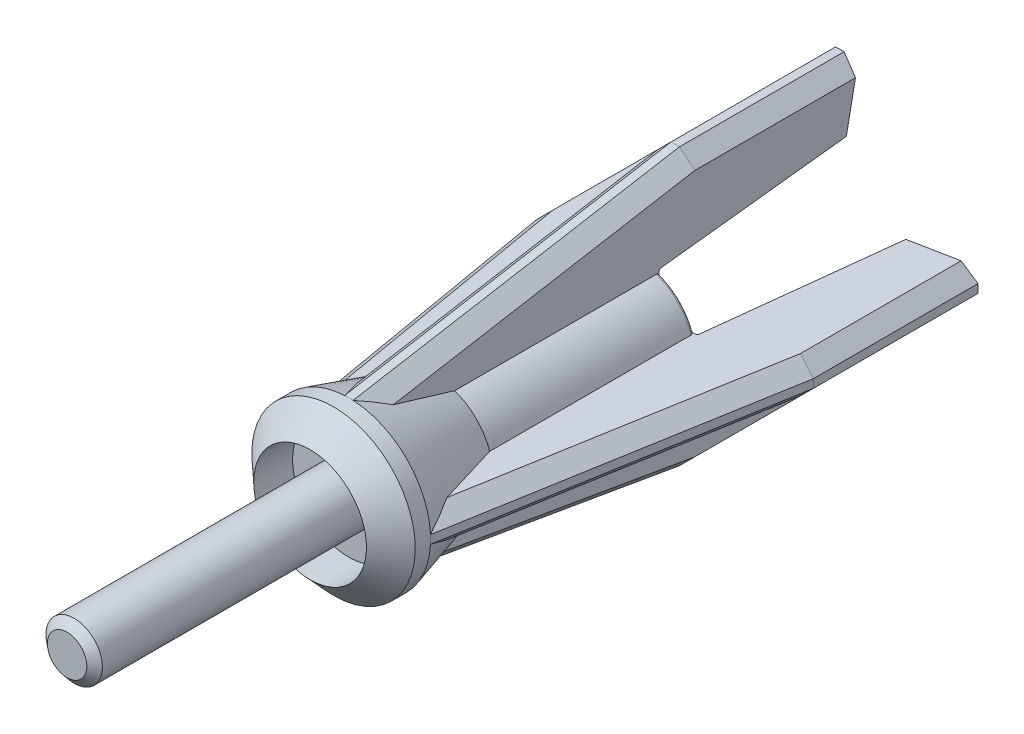
from build123d import *

# Parameters (mm, degrees)
EXTRUDE_1_DEPTH                      = 0.65
CHAMFER_1_SIZE                       = 0.5
PATTERN_CIRCULAR_2_COUNT             = 4
CHAMFER_1_OF_PATTERN_CIRCULAR_2_SIZE = 0.5
FILLET_1_R                           = 0.1


with BuildPart() as part:
    # 스케치1 → 회전1 (revolve)
    with BuildSketch(Plane(origin=(0, 0, 0), x_dir=(1, 0, 0), z_dir=(0, 1, 0)), mode=Mode.PRIVATE) as revolve_1_sk:
        Polygon((0, 0), (1.5, 0.34993434), (2, 0.34993434), (2, -10), (1, -10), (1, -19.748270111), (0.7, -20), (0, -20), align=None)
    revolve(revolve_1_sk.sketch.rotate(Axis((0, 0, 0), (0, 0, 1)), 180), axis=Axis((0, 0, 0), (0, 0, 1)))

    # 스케치2 → 보스-돌출1 (add, symmetric)
    with BuildSketch(Plane(origin=(0, 0, 0), x_dir=(0, 0, -1), z_dir=(1, 0, 0))):
        Polygon((-10, 2.9), (1.575466057, 4.9), (7.420556651, 4.9), (7, 2.759707009), (0.34993434, 2), (0.34993434, 1.4), (-10, 1.4), align=None)
    extrude_1 = extrude(amount=EXTRUDE_1_DEPTH, both=True)

    # 모따기1
    chamfer_1_edges = [part.edges().sort_by_distance(p)[0] for p in [
        (0.65, 4.9, -4.498011354),
        (0.65, 3.9, 4.212266971),
        (-0.65, 4.9, -4.498011354),
        (-0.65, 3.9, 4.212266971),
    ]]
    chamfer(chamfer_1_edges, length=CHAMFER_1_SIZE)

    # 원형 패턴2: 보스-돌출1 ×4 about axis
    pattern_circular_2_axis = Axis((0, 0, 0), (0, 0, 1))
    for i in range(1, PATTERN_CIRCULAR_2_COUNT):
        add(extrude_1.rotate(pattern_circular_2_axis, i * 360 / PATTERN_CIRCULAR_2_COUNT))

    # 모따기1 of 원형 패턴2
    chamfer_1_of_pattern_circular_2_edges = [part.edges().sort_by_distance(p)[0] for p in [
        (-4.9, 0.65, -4.498011354),
        (-3.9, 0.65, 4.212266971),
        (-4.9, -0.65, -4.498011354),
        (-3.9, -0.65, 4.212266971),
        (-0.65, -4.9, -4.498011354),
        (-0.65, -3.9, 4.212266971),
        (0.65, -4.9, -4.498011354),
        (0.65, -3.9, 4.212266971),
        (4.9, -0.65, -4.498011354),
        (3.9, -0.65, 4.212266971),
        (4.9, 0.65, -4.498011354),
        (3.9, 0.65, 4.212266971),
    ]]
    chamfer(chamfer_1_of_pattern_circular_2_edges, length=CHAMFER_1_OF_PATTERN_CIRCULAR_2_SIZE)

    # 필렛1
    fillet_1_edges = [part.edges().sort_by_distance(p)[0] for p in [
        (0, -2, -0.34993434),
        (-1.414213562, 1.414213562, -0.34993434),
        (1.414213562, 1.414213562, -0.34993434),
        (0, 2, -0.34993434),
        (1.414213562, -1.414213562, -0.34993434),
        (2, 0, -0.34993434),
        (-1.414213562, -1.414213562, -0.34993434),
    ]]
    fillet(fillet_1_edges, radius=FILLET_1_R)

    # 스케치3 → 회전2 (revolve)
    with BuildSketch(Plane(origin=(0, 0, 0), x_dir=(0, 0, -1), z_dir=(1, 0, 0)), mode=Mode.PRIVATE) as revolve_2_sk:
        Polygon((-10, 2.9), (0, 0), (-10, 0), (-10, 2), (-11.378788521, 2), (-10.54680135, 2.9), align=None)
    revolve(revolve_2_sk.sketch.rotate(Axis((0, 0, 0), (0, 0, 1)), 90), axis=Axis((0, 0, 0), (0, 0, 1)))


solid = part.part
